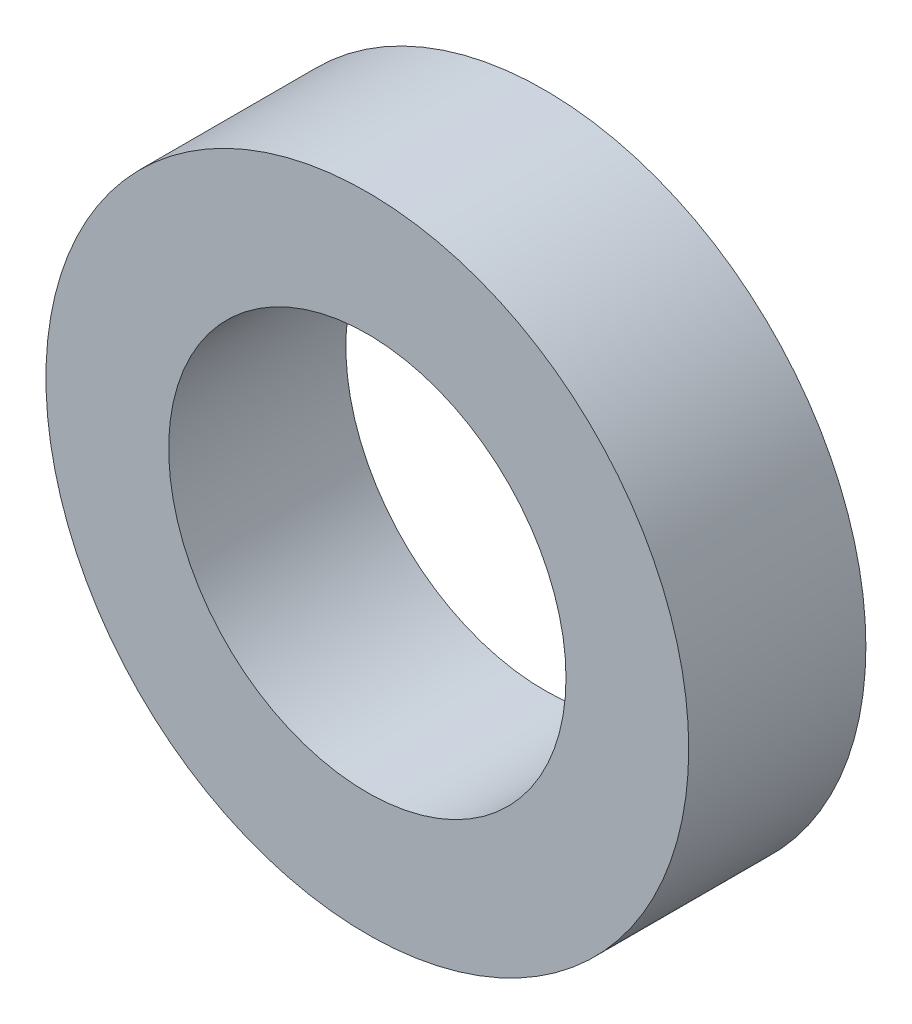
from build123d import *

# Parameters (mm, degrees)
TIRE_REFERENCE_START = -35
SKETCH_1_R           = 127
SKETCH_1_R_2         = 78.5
TIRE_REFERENCE_DEPTH = 70


with BuildPart() as part:
    # Эскиз1 → Tire_reference (new body)
    with BuildSketch(Plane.XY.offset(TIRE_REFERENCE_START)):
        Circle(SKETCH_1_R)
        Circle(SKETCH_1_R_2, mode=Mode.SUBTRACT)
    extrude(amount=TIRE_REFERENCE_DEPTH)


solid = part.part
